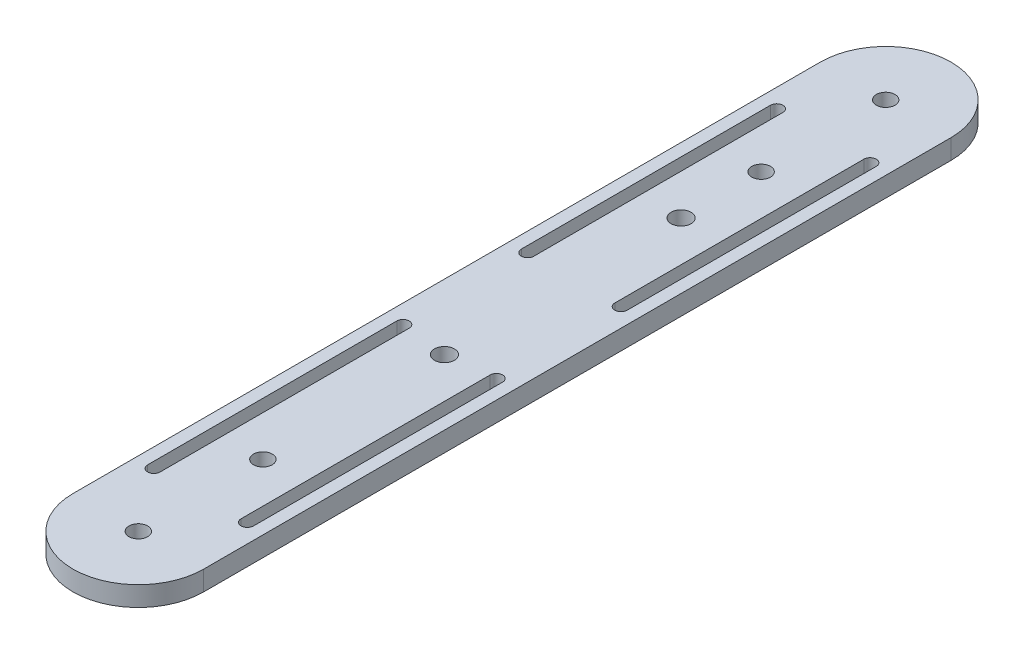
from build123d import *

# Parameters (mm, degrees)
SKETCH1_R               = 1.5
BOSS_EXTRUDE1_DEPTH     = 3.175
CUT_EXTRUDE1_DEPTH      = 131.960225355
CUT_EXTRUDE1_DEPTH_BACK = 131.960225355
SKETCH2_R               = 1.5
CUT_EXTRUDE2_DEPTH      = 131.960225355
CUT_EXTRUDE2_DEPTH_BACK = 131.960225355
SKETCH3_R               = 1.5
CUT_EXTRUDE4_DEPTH      = 40
SKETCH6_R               = 1.6
CUT_EXTRUDE5_DEPTH      = 10


with BuildPart() as part:
    # Sketch1 → Boss-Extrude1 (new body)
    with BuildSketch(Plane(origin=(0, 0, 0), x_dir=(1, 0, 0), z_dir=(0, 1, 0))):
        with BuildLine():
            Line((-10.5, 0), (-10.5, -120))
            ThreePointArc((-10.5, -120), (0, -130.5), (10.5, -120))
            Line((10.5, -120), (10.5, 0))
            ThreePointArc((10.5, 0), (0, 10.5), (-10.5, 0))
        make_face()
        with Locations(Location((0, 0, 0), (0, 0, 270))):
            Circle(SKETCH1_R, mode=Mode.SUBTRACT)
        with Locations(Location((0, -120, 0), (0, 0, 270))):
            Circle(SKETCH1_R, mode=Mode.SUBTRACT)
    extrude(amount=BOSS_EXTRUDE1_DEPTH)

    # Sketch2 → Cut-Extrude1 (cut, two sides: drawn at the far end of the back side and taken through both)
    with BuildSketch(Plane.XZ.offset(-CUT_EXTRUDE1_DEPTH_BACK)):
        with Locations(Location((0, 20, 0), (0, 0, 270))):
            Circle(SKETCH2_R)
    extrude(amount=CUT_EXTRUDE1_DEPTH + CUT_EXTRUDE1_DEPTH_BACK, mode=Mode.SUBTRACT)

    # Sketch3 → Cut-Extrude2 (cut, two sides: drawn at the far end of the back side and taken through both)
    with BuildSketch(Plane(origin=(0, 3.175, 0), x_dir=(1, 0, 0), z_dir=(0, 1, 0)).offset(-CUT_EXTRUDE2_DEPTH_BACK)):
        with Locations(Location((0, -100, 0), (0, 0, 270))):
            Circle(SKETCH3_R)
    extrude(amount=CUT_EXTRUDE2_DEPTH + CUT_EXTRUDE2_DEPTH_BACK, mode=Mode.SUBTRACT)

    # Sketch5 → Cut-Extrude4 (cut)
    with BuildSketch(Plane.XZ):
        with BuildLine():
            Line((-8.5, 10), (-8.5, 50))
            ThreePointArc((-8.5, 50), (-7.5, 51), (-6.5, 50))
            Line((-6.5, 50), (-6.5, 10))
            ThreePointArc((-6.5, 10), (-7.5, 9), (-8.5, 10))
        make_face()
        with BuildLine():
            Line((6.5, 50), (6.5, 10))
            ThreePointArc((6.5, 10), (7.5, 9), (8.5, 10))
            Line((8.5, 10), (8.5, 50))
            ThreePointArc((8.5, 50), (7.5, 51), (6.5, 50))
        make_face()
        with BuildLine():
            Line((8.5, 110), (8.5, 70))
            ThreePointArc((8.5, 70), (7.5, 69), (6.5, 70))
            Line((6.5, 70), (6.5, 110))
            ThreePointArc((6.5, 110), (7.5, 111), (8.5, 110))
        make_face()
        with BuildLine():
            Line((-6.5, 70), (-6.5, 110))
            ThreePointArc((-6.5, 110), (-7.5, 111), (-8.5, 110))
            Line((-8.5, 110), (-8.5, 70))
            ThreePointArc((-8.5, 70), (-7.5, 69), (-6.5, 70))
        make_face()
    extrude(amount=-CUT_EXTRUDE4_DEPTH, mode=Mode.SUBTRACT)

    # Sketch6 → Cut-Extrude5 (cut)
    with BuildSketch(Plane.XZ):
        with Locations(Location((0, 70.85, 0), (0, 0, 270))):
            Circle(SKETCH6_R)
        with Locations(Location((0, 32.85, 0), (0, 0, 270))):
            Circle(SKETCH6_R)
    extrude(amount=-CUT_EXTRUDE5_DEPTH, mode=Mode.SUBTRACT)


solid = part.part
